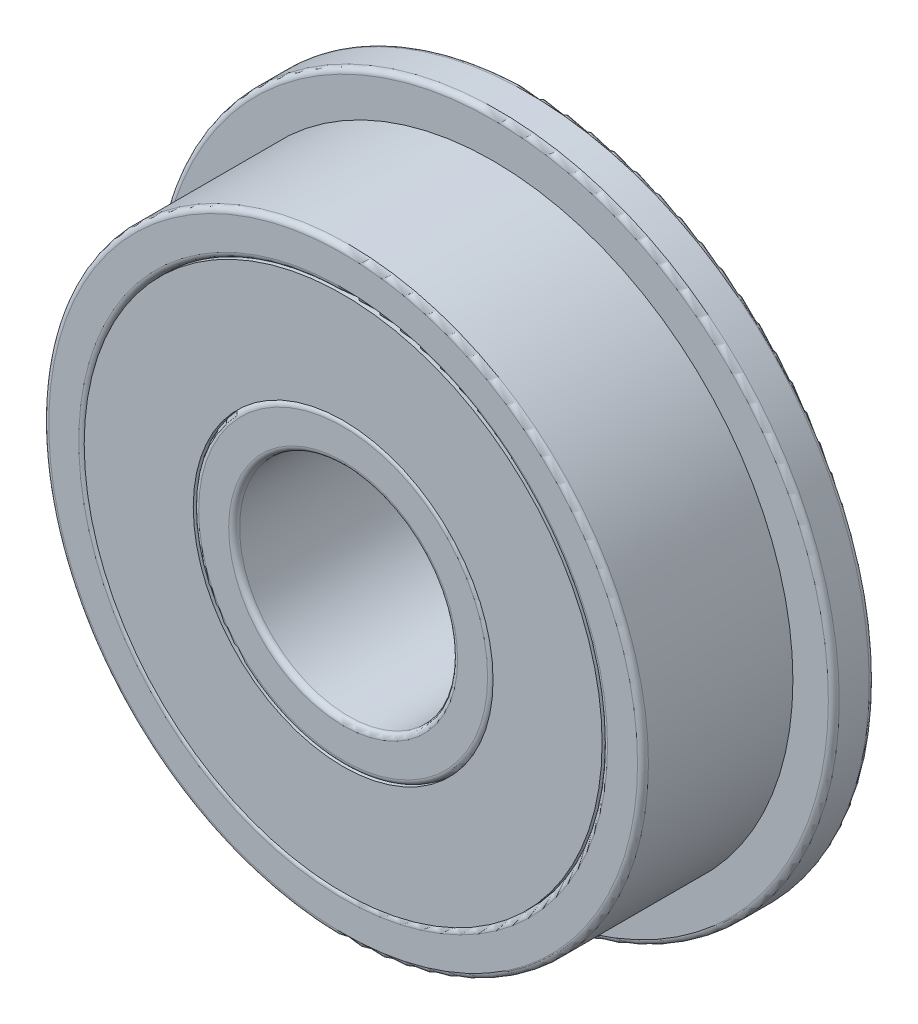
from build123d import *

# Parameters (mm, degrees)
SKETCH1_R             = 11
SKETCH1_R_2           = 9.5
BOSS_EXTRUDE1_DEPTH   = 7
SKETCH1_R_3           = 5.5
SKETCH1_R_4           = 4
BOSS_EXTRUDE1_2_DEPTH = 7
FILLET2_R             = 0.2
SKETCH1_3_R           = 9.5
SKETCH1_3_R_2         = 5.5
BOSS_EXTRUDE2_DEPTH   = 7
SKETCH2_R             = 12.5
SKETCH2_R_2           = 10.5
BOSS_EXTRUDE3_DEPTH   = 1.5
FILLET1_R             = 0.2


with BuildPart() as part:
    # Sketch1 → Boss-Extrude1 (new body)
    with BuildSketch(Plane.XY):
        Circle(SKETCH1_R)
        Circle(SKETCH1_R_2, mode=Mode.SUBTRACT)
    extrude(amount=BOSS_EXTRUDE1_DEPTH)

    # Sketch2 → Boss-Extrude3 (add)
    with BuildSketch(Plane.XY):
        Circle(SKETCH2_R)
        Circle(SKETCH2_R_2, mode=Mode.SUBTRACT)
    extrude(amount=BOSS_EXTRUDE3_DEPTH)

    # Fillet1
    fillet1_edges = [part.edges().sort_by_distance(p)[0] for p in [
        (-9.5, 0, 0),
        (-11, 0, 7),
        (-9.5, 0, 7),
        (-12.5, 0, 0),
        (-12.5, 0, 1.5),
    ]]
    fillet(fillet1_edges, radius=FILLET1_R)


with BuildPart() as body_2:
    # Sketch1 → Boss-Extrude1 2 (new body)
    with BuildSketch(Plane.XY):
        Circle(SKETCH1_R_3)
        Circle(SKETCH1_R_4, mode=Mode.SUBTRACT)
    extrude(amount=BOSS_EXTRUDE1_2_DEPTH)

    # Fillet2
    fillet2_edges = [body_2.edges().sort_by_distance(p)[0] for p in [
        (-5.5, 0, 0),
        (-4, 0, 0),
        (-5.5, 0, 7),
        (-4, 0, 7),
    ]]
    fillet(fillet2_edges, radius=FILLET2_R)


with BuildPart() as body_3:
    # Sketch1<3> → Boss-Extrude2 (new body)
    with BuildSketch(Plane.XY):
        Circle(SKETCH1_3_R)
        Circle(SKETCH1_3_R_2, mode=Mode.SUBTRACT)
    extrude(amount=BOSS_EXTRUDE2_DEPTH)


solid = Compound([part.part, body_2.part, body_3.part])
